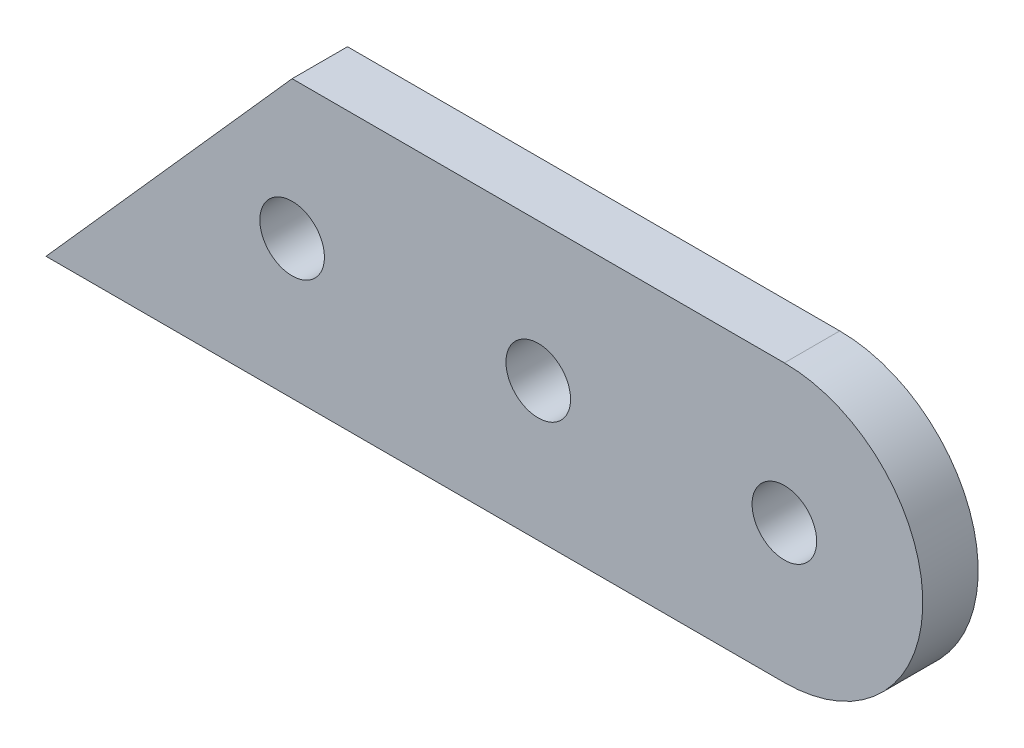
from build123d import *

# Parameters (mm, degrees)
SKETCH_1_R      = 1.75
EXTRUDE_1_DEPTH = 3


with BuildPart() as part:
    # 草圖1 → 伸長1 (new body)
    with BuildSketch(Plane.XY):
        with BuildLine():
            Line((-6.666666667, 7.5), (20, 7.5))
            ThreePointArc((20, 7.5), (27.5, 0), (20, -7.5))
            Line((20, -7.5), (-20, -7.5))
            Line((-20, -7.5), (-6.666666667, 7.5))
        make_face()
        with Locations((20, 0)):
            Circle(SKETCH_1_R, mode=Mode.SUBTRACT)
        with Locations((-6.666666667, 0)):
            Circle(SKETCH_1_R, mode=Mode.SUBTRACT)
        with Locations((6.666666667, 0)):
            Circle(SKETCH_1_R, mode=Mode.SUBTRACT)
    extrude(amount=EXTRUDE_1_DEPTH)


solid = part.part
